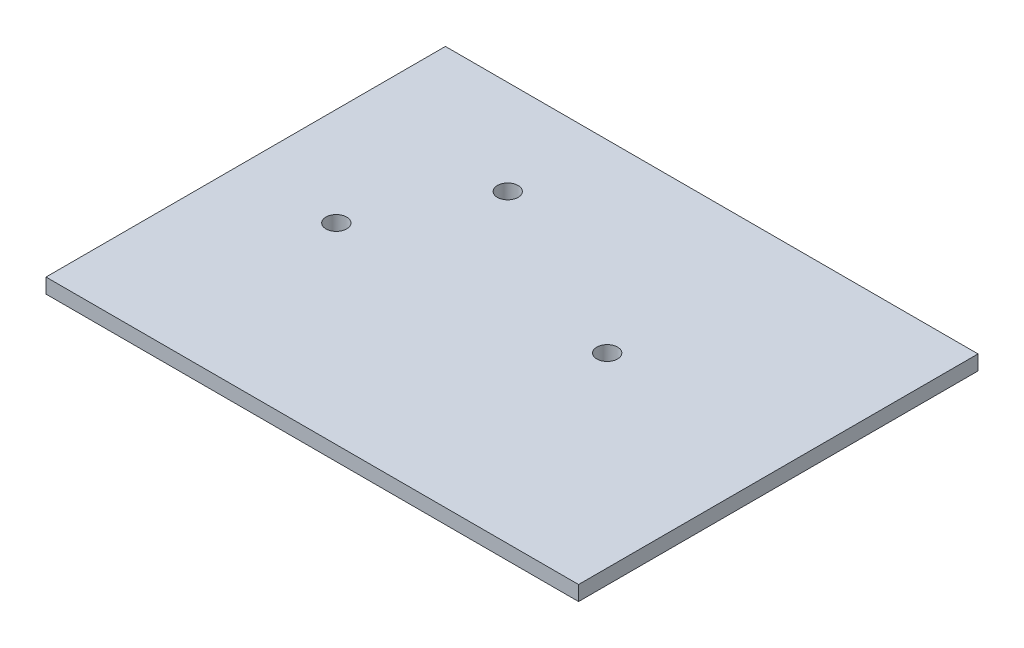
from build123d import *

# Parameters (mm, degrees)
SKETCH1_W           = 180
SKETCH1_H           = 135
BOSS_EXTRUDE1_DEPTH = 5
SKETCH5_OUTSIDE_W   = 227.012
SKETCH5_OUTSIDE_H   = 182.012
SKETCH5_OUTSIDE_W_2 = 180
SKETCH5_OUTSIDE_H_2 = 135
SKETCH5_OUTSIDE_R   = 3.5
CUT_EXTRUDE2_DEPTH  = 226.055548699


with BuildPart() as part:
    # Sketch1 → Boss-Extrude1 (new body)
    with BuildSketch(Plane(origin=(0, 0, 0), x_dir=(1, 0, 0), z_dir=(0, 1, 0))):
        with Locations((90, 67.5)):
            Rectangle(SKETCH1_W, SKETCH1_H)
    extrude(amount=BOSS_EXTRUDE1_DEPTH)

    # Sketch5 outside → Cut-Extrude2 (cut, through all)
    # profile 1 of 4: a face of its own
    with BuildSketch(Plane(origin=(0, 5, 0), x_dir=(1, 0, 0), z_dir=(0, 1, 0))):
        with Locations((90, 67.5)):
            Rectangle(SKETCH5_OUTSIDE_W, SKETCH5_OUTSIDE_H)
        with Locations((90, 67.5)):
            Rectangle(SKETCH5_OUTSIDE_W_2, SKETCH5_OUTSIDE_H_2, mode=Mode.SUBTRACT)
    # profile 2 of 4: a face of its own
    with BuildSketch(Plane(origin=(0, 5, 0), x_dir=(1, 0, 0), z_dir=(0, 1, 0))):
        with Locations(Location((52.971072195, 103.086051909, 0), (0, 0, 270))):
            Circle(SKETCH5_OUTSIDE_R)
    # profile 3 of 4: a face of its own
    with BuildSketch(Plane(origin=(0, 5, 0), x_dir=(1, 0, 0), z_dir=(0, 1, 0))):
        with Locations(Location((117.085590552, 72.584764462, 0), (0, 0, 270))):
            Circle(SKETCH5_OUTSIDE_R)
    # profile 4 of 4: a face of its own
    with BuildSketch(Plane(origin=(0, 5, 0), x_dir=(1, 0, 0), z_dir=(0, 1, 0))):
        with Locations(Location((33.237075338, 64.881741052, 0), (0, 0, 270))):
            Circle(SKETCH5_OUTSIDE_R)
    extrude(amount=-CUT_EXTRUDE2_DEPTH, mode=Mode.SUBTRACT)


solid = part.part
